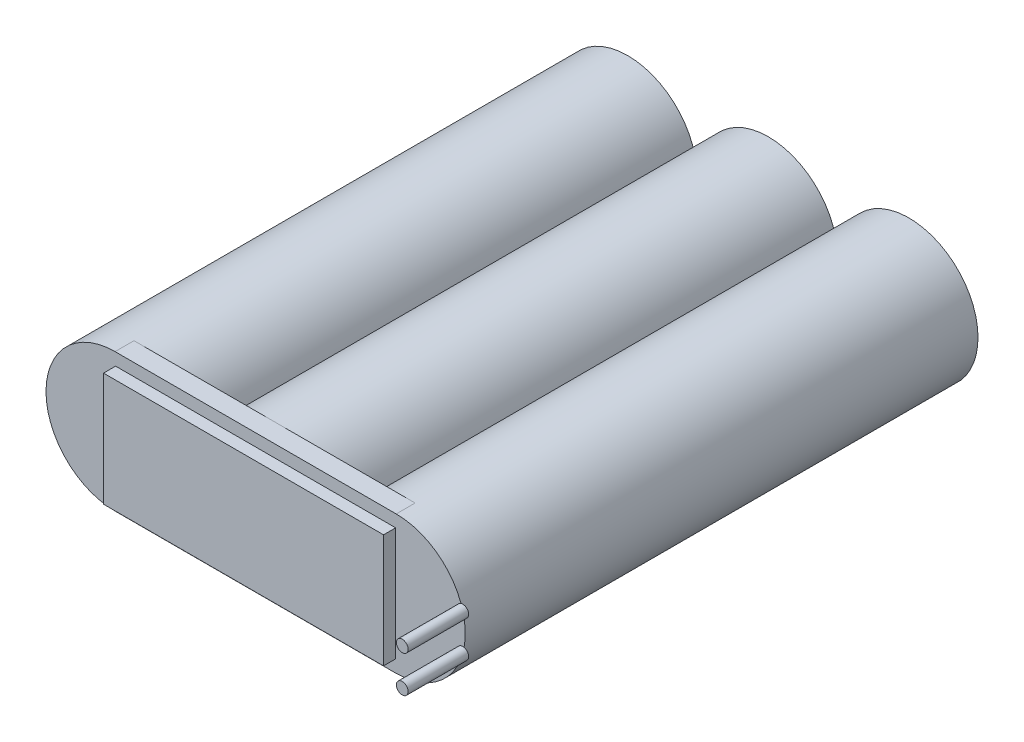
from build123d import *

# Parameters (mm, degrees)
SKETCH1_R             = 9.125
BOSS_EXTRUDE1_DEPTH   = 32.625
BOSS_EXTRUDE1_2_DEPTH = 32.625
BOSS_EXTRUDE1_3_DEPTH = 32.625
BOSS_EXTRUDE2_DEPTH   = 2.5
SKETCH3_W             = 37
SKETCH3_H             = 15
BOSS_EXTRUDE3_DEPTH   = 1.6
SKETCH4_R             = 0.775
BOSS_EXTRUDE4_DEPTH   = 8


with BuildPart() as part:
    # Sketch1 → Boss-Extrude1 (new, symmetric)
    with BuildSketch(Plane.XY):
        Circle(SKETCH1_R)
    extrude(amount=BOSS_EXTRUDE1_DEPTH, both=True)



with BuildPart() as body_2:
    # Sketch1 → Boss-Extrude1 2 (new, symmetric)
    with BuildSketch(Plane.XY):
        with Locations((18.575, 0)):
            Circle(SKETCH1_R)
    extrude(amount=BOSS_EXTRUDE1_2_DEPTH, both=True)


with BuildPart() as body_3:
    # Sketch1 → Boss-Extrude1 3 (new, symmetric)
    with BuildSketch(Plane.XY):
        with Locations((-18.575, 0)):
            Circle(SKETCH1_R)
    extrude(amount=BOSS_EXTRUDE1_3_DEPTH, both=True)


with BuildPart() as part_1:
    add(part.part)

    add(body_2.part)  # Boss-Extrude2 merges body 2

    add(body_3.part)  # Boss-Extrude2 merges body 3
    # Sketch2 → Boss-Extrude2 (add)
    with BuildSketch(Plane.XY.offset(32.625)):
        with BuildLine():
            Line((-18.575, 9.125), (18.575, 9.125))
            ThreePointArc((18.575, 9.125), (27.7, 0), (18.575, -9.125))
            Line((18.575, -9.125), (-18.575, -9.125))
            ThreePointArc((-18.575, -9.125), (-27.7, 0), (-18.575, 9.125))
        make_face()
    extrude(amount=BOSS_EXTRUDE2_DEPTH)

    # Sketch3 → Boss-Extrude3 (add)
    with BuildSketch(Plane.XY.offset(35.125)):
        Rectangle(SKETCH3_W, SKETCH3_H)
    extrude(amount=BOSS_EXTRUDE3_DEPTH)

    # Sketch4 → Boss-Extrude4 (add)
    with BuildSketch(Plane.XY.offset(35.125)):
        with Locations(Location((27.373251247, 2.42, 0), (0, 0, 107.8130031))):
            Circle(SKETCH4_R)
        with Locations(Location((27.373251247, -2.42, 0), (0, 0, 252.1869969))):
            Circle(SKETCH4_R)
    extrude(amount=BOSS_EXTRUDE4_DEPTH)


solid = part_1.part
